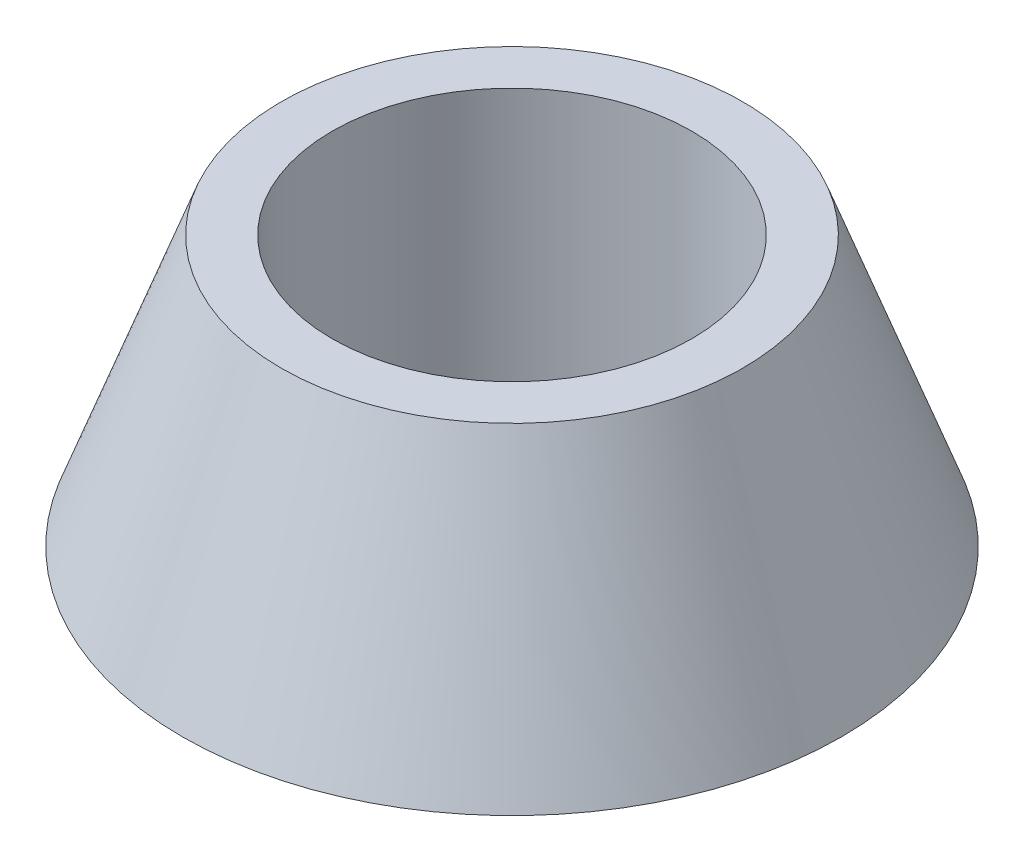
from build123d import *


with BuildPart() as part:
    # Szkic1 → Obrót1 (revolve)
    with BuildSketch(Plane.XY, mode=Mode.PRIVATE) as obr_t1_sk:
        Polygon((6, 4.5), (6, -4.5), (11, -4.5), (7.7, 4.5), align=None)
    revolve(obr_t1_sk.sketch.rotate(Axis((0, 7.920708236, 0), (0, -1, 0)), 90), axis=Axis((0, 7.920708236, 0), (0, -1, 0)))


solid = part.part
